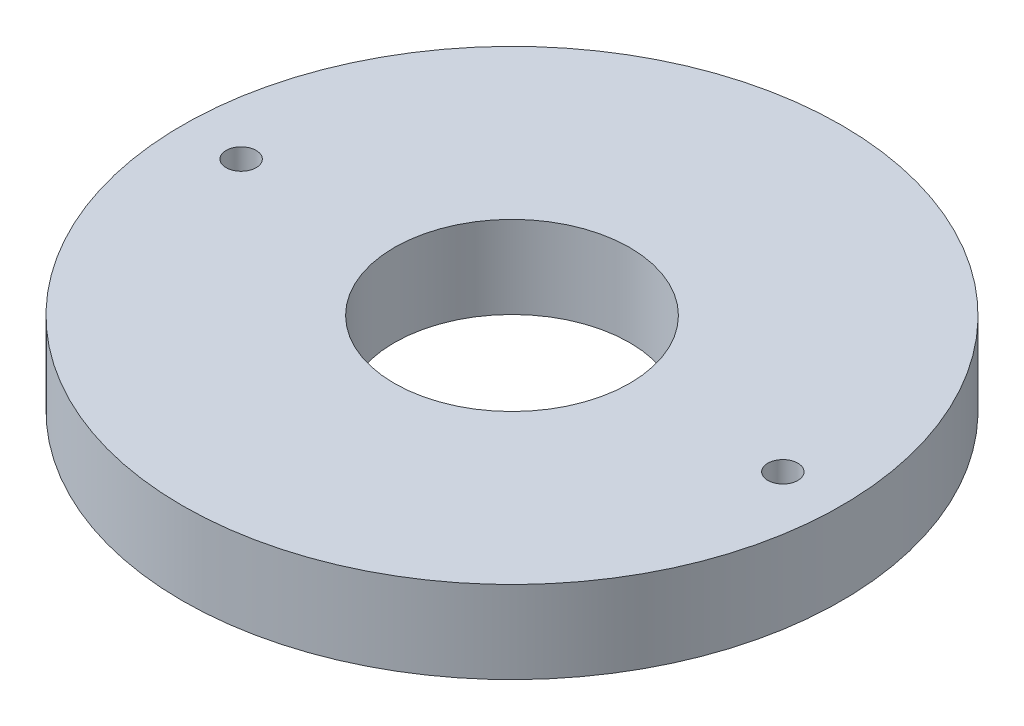
from build123d import *

# Parameters (mm, degrees)
SKETCH1_R           = 28
BOSS_EXTRUDE1_DEPTH = 7
SKETCH2_R           = 10
CUT_EXTRUDE1_DEPTH  = 41.211938526
SKETCH3_R           = 1.275
CUT_EXTRUDE2_DEPTH  = 41.211938526
CIRPATTERN1_COUNT   = 2


with BuildPart() as part:
    # Sketch1 → Boss-Extrude1 (new body)
    with BuildSketch(Plane(origin=(0, 0, 0), x_dir=(1, 0, 0), z_dir=(0, 1, 0))):
        with Locations(Location((0, 0, 0), (0, 0, 270))):
            Circle(SKETCH1_R)
    extrude(amount=BOSS_EXTRUDE1_DEPTH)

    # Sketch2 → Cut-Extrude1 (cut, through all)
    with BuildSketch(Plane(origin=(0, 0, 0), x_dir=(1, 0, 0), z_dir=(0, 1, 0))):
        with Locations(Location((0, 0, 0), (0, 0, 270))):
            Circle(SKETCH2_R)
    extrude(amount=CUT_EXTRUDE1_DEPTH, mode=Mode.SUBTRACT)

    # Sketch3 → Cut-Extrude2 (cut, through all)
    with BuildSketch(Plane(origin=(0, 0, 0), x_dir=(1, 0, 0), z_dir=(0, 1, 0))):
        with Locations(Location((23.0124, 0, 0), (0, 0, 270))):
            Circle(SKETCH3_R)
    cut_extrude2 = extrude(amount=CUT_EXTRUDE2_DEPTH, mode=Mode.SUBTRACT)

    # CirPattern1: Cut-Extrude2 ×2 about axis
    cirpattern1_axis = Axis((0, 0, 0), (0, 1, 0))
    for i in range(1, CIRPATTERN1_COUNT):
        add(cut_extrude2.rotate(cirpattern1_axis, i * 360 / CIRPATTERN1_COUNT), mode=Mode.SUBTRACT)


solid = part.part
